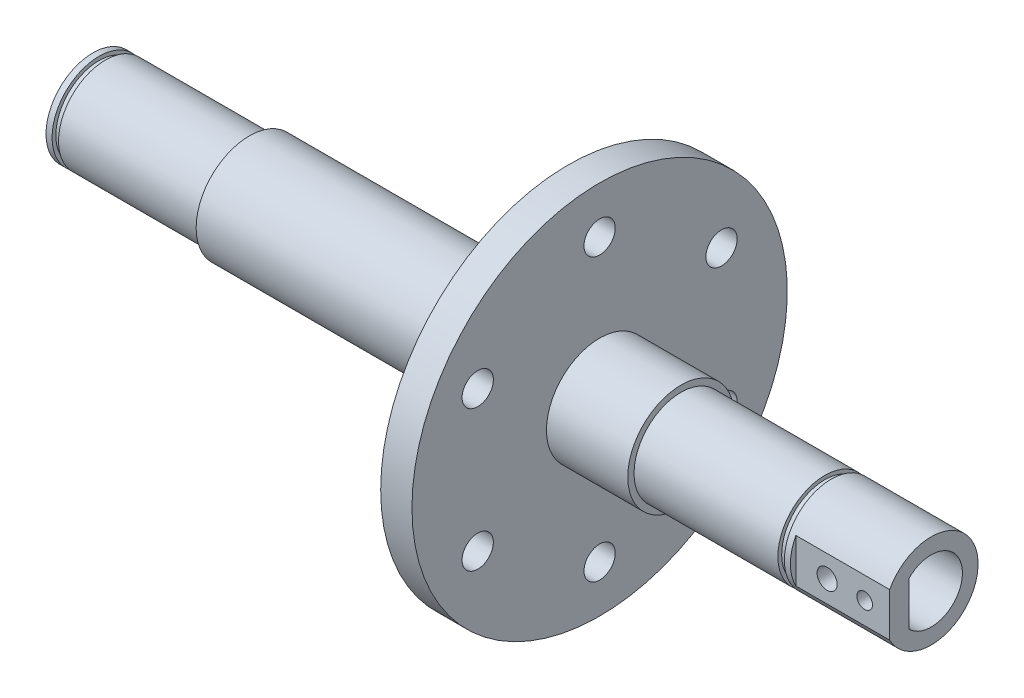
from build123d import *

# Parameters (mm, degrees)
SKETCH_2_R             = 2.5
CUT_EXTRUDE_1_DEPTH    = 88.040220588
CUT_EXTRUDE_2_DEPTH    = 14
CUT_EXTRUDE_START      = -15
CUT_EXTRUDE_3_DEPTH    = 15
SKETCH_5_R             = 1.6
CUT_EXTRUDE_4_DEPTH    = 143.119650207
HOLE_WIZARD_M3_1_D     = 2.5
HOLE_WIZARD_M3_1_DEPTH = 4
HOLE_WIZARD_M3_1_TIP   = 0.751075774
CUT_EXTRUDE_START_2    = 1.03
SKETCH_8_R             = 7.5
SKETCH_8_R_2           = 6.9
CUT_EXTRUDE_5_DEPTH    = 1.03
SKETCH_9_R             = 7.5
SKETCH_9_R_2           = 6.9
CUT_EXTRUDE_6_DEPTH    = 1.03


with BuildPart() as part:
    # 草图1 → 旋转1 (revolve)
    with BuildSketch(Plane.XY, mode=Mode.PRIVATE) as revolve_1_sk:
        Polygon((0, 0), (134, 0), (134, 7.5), (94, 7.5), (94, 8.5), (81, 8.5), (81, 30), (76, 30), (76, 8.5), (25, 8.5), (25, 7.5), (0, 7.5), align=None)
    revolve(revolve_1_sk.sketch.rotate(Axis((0, 0, 0), (1, 0, 0)), 90), axis=Axis((0, 0, 0), (1, 0, 0)))

    # 草图2 → 切除-拉伸1 (cut, through all)
    with BuildSketch(Plane.ZY.offset(-76)):
        with Locations(Location((0, 22.5, 0), (0, 0, 270))):
            Circle(SKETCH_2_R)
        with Locations(Location((19.485571585, 11.25, 0), (0, 0, 270))):
            Circle(SKETCH_2_R)
        with Locations(Location((19.485571585, -11.25, 0), (0, 0, 270))):
            Circle(SKETCH_2_R)
        with Locations(Location((0, -22.5, 0), (0, 0, 270))):
            Circle(SKETCH_2_R)
        with Locations(Location((-19.485571585, -11.25, 0), (0, 0, 270))):
            Circle(SKETCH_2_R)
        with Locations(Location((-19.485571585, 11.25, 0), (0, 0, 270))):
            Circle(SKETCH_2_R)
    extrude(amount=-CUT_EXTRUDE_1_DEPTH, mode=Mode.SUBTRACT)

    # 草图3 → 切除-拉伸2 (cut)
    with BuildSketch(Plane(origin=(134, 0, 0), x_dir=(0, 0, -1), z_dir=(1, 0, 0))):
        with BuildLine():
            Line((-3.570714214, 3.5), (-3.570714214, -3.5))
            ThreePointArc((-3.570714214, -3.5), (5, 0), (-3.570714214, 3.5))
        make_face()
    extrude(amount=-CUT_EXTRUDE_2_DEPTH, mode=Mode.SUBTRACT)

    # 草图4 → 切除-拉伸3 (cut)
    with BuildSketch(Plane(origin=(134, 0, 0), x_dir=(0, 0, -1), z_dir=(1, 0, 0)).offset(CUT_EXTRUDE_START)):
        with BuildLine():
            Line((-6.633249581, 3.5), (-6.633249581, -3.5))
            ThreePointArc((-6.633249581, -3.5), (-7.5, 0), (-6.633249581, 3.5))
        make_face()
    extrude(amount=CUT_EXTRUDE_3_DEPTH, mode=Mode.SUBTRACT)

    # 草图5 → 切除-拉伸4 (cut, through all)
    with BuildSketch(Plane.XY.offset(6.633249581)):
        with Locations((124, 0)):
            Circle(SKETCH_5_R)
    extrude(amount=-CUT_EXTRUDE_4_DEPTH, mode=Mode.SUBTRACT)

    # M3 螺纹孔1
    with Locations(Plane(origin=(130, 0, 6.633249581), x_dir=(1, 0, 0), z_dir=(0, 0, 1))):
        with Locations((0, 0)):
            Hole(HOLE_WIZARD_M3_1_D / 2, depth=HOLE_WIZARD_M3_1_DEPTH)
            with Locations((0, 0, -(HOLE_WIZARD_M3_1_DEPTH + HOLE_WIZARD_M3_1_TIP / 2))):  # 118° drill point
                Cone(0, HOLE_WIZARD_M3_1_D / 2, HOLE_WIZARD_M3_1_TIP, mode=Mode.SUBTRACT)

    # 草图8 → 切除-拉伸5 (cut)
    with BuildSketch(Plane.ZY.offset(-2).offset(CUT_EXTRUDE_START_2)):
        Circle(SKETCH_8_R)
        with Locations(Location((0, 0, 0), (0, 0, 270))):
            Circle(SKETCH_8_R_2, mode=Mode.SUBTRACT)
    extrude(amount=-CUT_EXTRUDE_5_DEPTH, mode=Mode.SUBTRACT)

    # 草图9 → 切除-拉伸6 (cut)
    with BuildSketch(Plane(origin=(117, 0, 0), x_dir=(0, 0, -1), z_dir=(1, 0, 0))):
        with Locations(Location((0, 0, 0), (0, 0, 180))):
            Circle(SKETCH_9_R)
        with Locations(Location((0, 0, 0), (0, 0, 270))):
            Circle(SKETCH_9_R_2, mode=Mode.SUBTRACT)
    extrude(amount=CUT_EXTRUDE_6_DEPTH, mode=Mode.SUBTRACT)


solid = part.part
